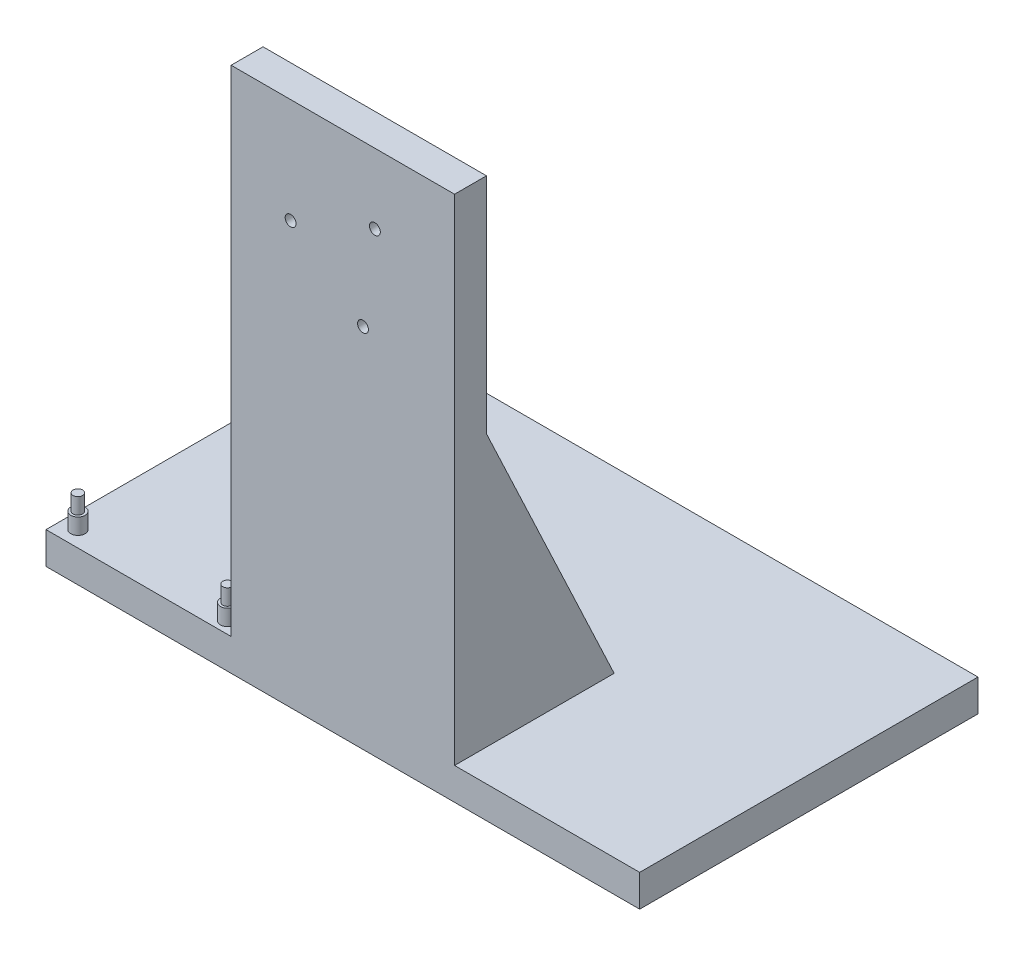
from build123d import *

# Parameters (mm, degrees)
SKETCH1_W                     = 70
SKETCH1_H                     = 70
BOSS_EXTRUDE1_DEPTH           = 10
CBORE_FOR_M3_SHCS1_AT_2_COUNT = 2
CBORE_FOR_M3_SHCS1_AT_2_PITCH = 28.578838325
CBORE_FOR_M3_SHCS1_AT_3_COUNT = 2
CBORE_FOR_M3_SHCS1_AT_3_PITCH = 28.578838325
SKETCH14_W                    = 70
SKETCH14_H                    = 10
BOSS_EXTRUDE2_DEPTH           = 95
SKETCH13_W                    = 186
SKETCH13_H                    = 106
BOSS_EXTRUDE3_DEPTH           = 10
CHAMFER1_SIZE                 = 40
CHAMFER1_SIZE2                = 85
SKETCH18_R                    = 2.25
BOSS_EXTRUDE4_DEPTH           = 5
SKETCH19_R                    = 1.5
BOSS_EXTRUDE5_DEPTH           = 5


with BuildPart() as part:
    # Sketch1 → Boss-Extrude1 (new body)
    with BuildSketch(Plane.XY):
        Rectangle(SKETCH1_W, SKETCH1_H)
    extrude(amount=BOSS_EXTRUDE1_DEPTH)

    # Sketch4 → CBORE for M3 SHCS1 (revolve, cut)
    with BuildSketch(Plane(origin=(6.314276634, -15.244012286, 0), x_dir=(0, 1, 0), z_dir=(1, 0, 0))):
        Polygon((0, 0), (0, 10), (1.7, 10), (1.7, 3), (3.25, 3), (3.25, 0.025), (3.275, 0), align=None)
    cbore_for_m3_shcs1 = revolve(axis=Axis((6.314276634, -15.244012286, -6.35), (0, 0, 1)), mode=Mode.SUBTRACT)

    # CBORE for M3 SHCS1 at 2: CBORE for M3 SHCS1 ×2
    with Locations(*[Vector(0.13052619222005196, 0.9914448613738104, 0) * (i * CBORE_FOR_M3_SHCS1_AT_2_PITCH) for i in range(1, CBORE_FOR_M3_SHCS1_AT_2_COUNT)]):
        add(cbore_for_m3_shcs1, mode=Mode.SUBTRACT)

    # CBORE for M3 SHCS1 at 3: CBORE for M3 SHCS1 ×2
    with Locations(*[Vector(-0.7933533402912364, 0.608761429008719, 0) * (i * CBORE_FOR_M3_SHCS1_AT_3_PITCH) for i in range(1, CBORE_FOR_M3_SHCS1_AT_3_COUNT)]):
        add(cbore_for_m3_shcs1, mode=Mode.SUBTRACT)

    # Sketch14 → Boss-Extrude2 (add)
    with BuildSketch(Plane.XZ.offset(35)):
        with Locations((0, 5)):
            Rectangle(SKETCH14_W, SKETCH14_H)
    extrude(amount=BOSS_EXTRUDE2_DEPTH)

    # Sketch13 → Boss-Extrude3 (add)
    with BuildSketch(Plane.XZ.offset(130)):
        with Locations((0, -43)):
            Rectangle(SKETCH13_W, SKETCH13_H)
    extrude(amount=-BOSS_EXTRUDE3_DEPTH)

    # Chamfer1
    chamfer1_edges = [part.edges().sort_by_distance(p)[0] for p in [
        (0, -120, 0),
    ]]
    chamfer1_side = [part.faces().sort_by_distance(p)[0] for p in [
        (0, -120, -44.766933109),
    ]]
    chamfer(chamfer1_edges, length=CHAMFER1_SIZE, length2=CHAMFER1_SIZE2, reference=chamfer1_side[0])

    # Sketch18 → Boss-Extrude4 (add)
    with BuildSketch(Plane(origin=(0, -120, -115), x_dir=(1, 0, 0), z_dir=(0, 1, 0))):
        with Locations(Location((-88, -45.1, 0), (0, 0, 90))):
            Circle(SKETCH18_R)
        with Locations(Location((-44.9, -69.2, 0), (0, 0, 90))):
            Circle(SKETCH18_R)
        with Locations(Location((-72.8, -69.2, 0), (0, 0, 90))):
            Circle(SKETCH18_R)
        with Locations(Location((-88, -120, 0), (0, 0, 90))):
            Circle(SKETCH18_R)
        with Locations(Location((-39.8, -121.3, 0), (0, 0, 90))):
            Circle(SKETCH18_R)
    extrude(amount=BOSS_EXTRUDE4_DEPTH)

    # Sketch19 → Boss-Extrude5 (add)
    with BuildSketch(Plane(origin=(0, -115, 0), x_dir=(1, 0, 0), z_dir=(0, 1, 0))):
        with Locations(Location((-88, 69.9, 0), (0, 0, 270))):
            Circle(SKETCH19_R)
        with Locations(Location((-72.8, 45.8, 0), (0, 0, 270))):
            Circle(SKETCH19_R)
        with Locations(Location((-44.9, 45.8, 0), (0, 0, 270))):
            Circle(SKETCH19_R)
        with Locations(Location((-88, -5, 0), (0, 0, 270))):
            Circle(SKETCH19_R)
        with Locations(Location((-39.8, -6.3, 0), (0, 0, 270))):
            Circle(SKETCH19_R)
    extrude(amount=BOSS_EXTRUDE5_DEPTH)


solid = part.part
